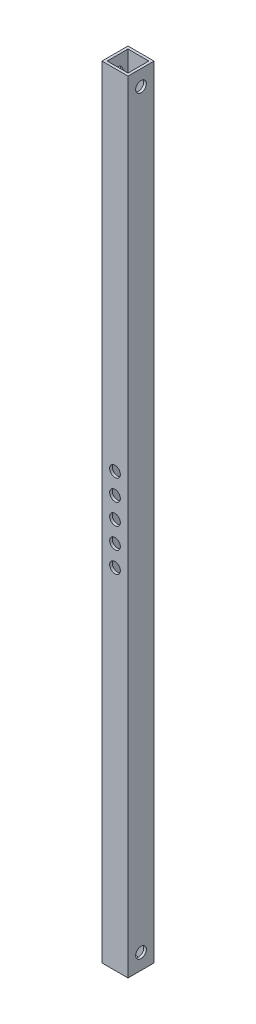
from build123d import *

# Parameters (mm, degrees)
SKETCH1_W           = 10
SKETCH1_H           = 10
SKETCH1_W_2         = 8
SKETCH1_H_2         = 8
BOSS_EXTRUDE1_DEPTH = 300
SKETCH2_R           = 2.05
CUT_EXTRUDE1_DEPTH  = 301.208261046
SKETCH3_R           = 2.05
CUT_EXTRUDE2_DEPTH  = 301.208261046


with BuildPart() as part:
    # Sketch1 → Boss-Extrude1 (new body)
    with BuildSketch(Plane(origin=(0, 0, 0), x_dir=(1, 0, 0), z_dir=(0, 1, 0))):
        Rectangle(SKETCH1_W, SKETCH1_H)
        Rectangle(SKETCH1_W_2, SKETCH1_H_2, mode=Mode.SUBTRACT)
    extrude(amount=BOSS_EXTRUDE1_DEPTH)

    # Sketch2 → Cut-Extrude1 (cut, through all)
    with BuildSketch(Plane(origin=(5, 0, 0), x_dir=(0, 0, -1), z_dir=(1, 0, 0))):
        with Locations((0, 294)):
            Circle(SKETCH2_R)
        with Locations((0, 6)):
            Circle(SKETCH2_R)
    extrude(amount=-CUT_EXTRUDE1_DEPTH, mode=Mode.SUBTRACT)

    # Sketch3 → Cut-Extrude2 (cut, through all)
    with BuildSketch(Plane.XY.offset(5)):
        with Locations((0, 150)):
            Circle(SKETCH3_R)
        with Locations((0, 158)):
            Circle(SKETCH3_R)
        with Locations((0, 166)):
            Circle(SKETCH3_R)
        with Locations((0, 142)):
            Circle(SKETCH3_R)
        with Locations((0, 134)):
            Circle(SKETCH3_R)
    extrude(amount=-CUT_EXTRUDE2_DEPTH, mode=Mode.SUBTRACT)


solid = part.part
